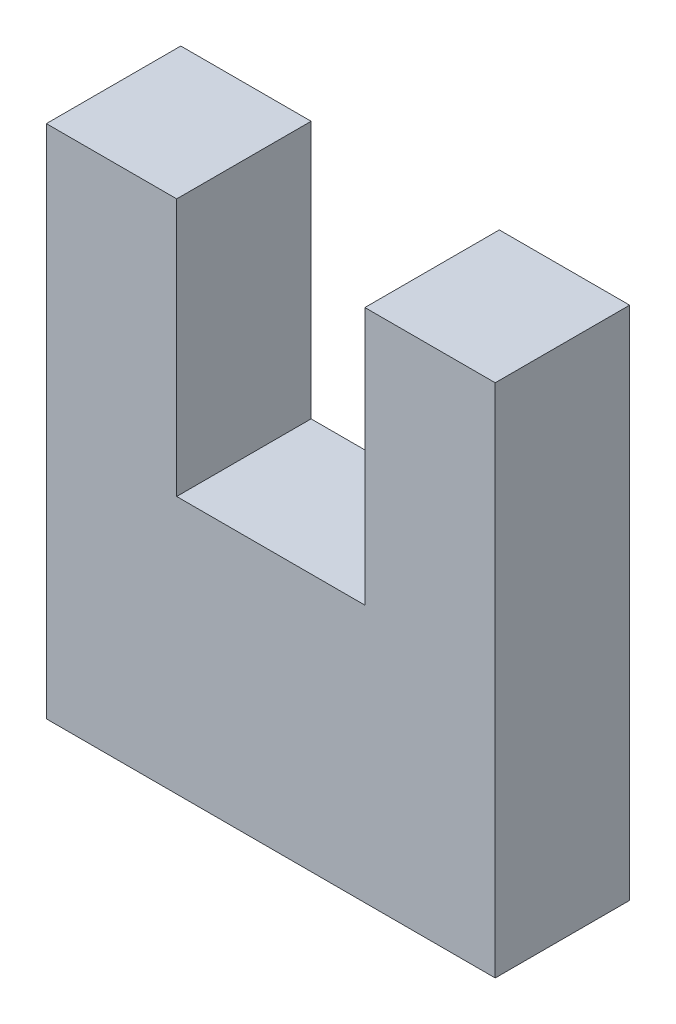
from build123d import *

# Parameters (mm, degrees)
SKETCH1_W           = 29.2608
SKETCH1_H           = 8.763
BOSS_EXTRUDE2_DEPTH = 16.8021
SKETCH2_W           = 8.4963
SKETCH2_H           = 8.763
BOSS_EXTRUDE3_DEPTH = 16.8021


with BuildPart() as part:
    # Sketch1 → Boss-Extrude2 (new body)
    with BuildSketch(Plane(origin=(0, 0, 0), x_dir=(1, 0, 0), z_dir=(0, 1, 0))):
        with Locations((14.6304, 4.3815)):
            Rectangle(SKETCH1_W, SKETCH1_H)
    extrude(amount=BOSS_EXTRUDE2_DEPTH)

    # Sketch2 → Boss-Extrude3 (add)
    with BuildSketch(Plane(origin=(0, 16.8021, 0), x_dir=(1, 0, 0), z_dir=(0, 1, 0))):
        with Locations((4.24815, 4.3815)):
            Rectangle(SKETCH2_W, SKETCH2_H)
        with Locations((25.01265, 4.3815)):
            Rectangle(SKETCH2_W, SKETCH2_H)
    extrude(amount=BOSS_EXTRUDE3_DEPTH)


solid = part.part
